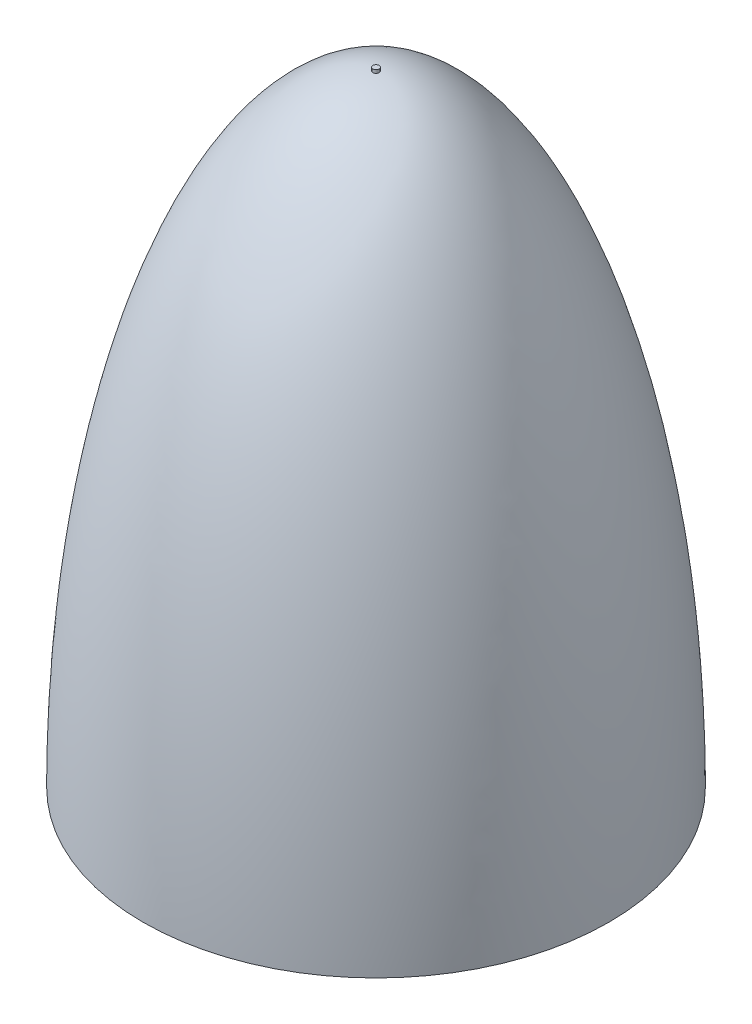
from build123d import *

# Parameters (mm, degrees)
SKETCH1_W = 4
SKETCH1_H = 4


with BuildPart() as part:
    # Sketch1 → Revolve1 (revolve)
    with BuildSketch(Plane.XY, mode=Mode.PRIVATE) as revolve1_sk:
        with BuildLine():
            add(Edge.make_bspline(
                [(4, -0.071114272), (2.000088897, 0), (0, 0)],
                knots=[6.269851579, 6.269851579, 6.269851579, 6.283185307, 6.283185307, 6.283185307], degree=2, weights=[1, 0.999977777, 1]))
            Line((0, 0), (300, -800))
            add(Edge.make_bspline(
                [(300, -800), (300, -10.596494347), (4, -0.071114272)],
                knots=[4.71238898, 4.71238898, 4.71238898, 6.269851579, 6.269851579, 6.269851579], degree=2, weights=[1, 0.711805217, 1]))
        make_face()
        with BuildLine():
            Line((4, 0), (0, 0))
            add(Edge.make_bspline(
                [(4, -0.071114272), (2.000088897, 0), (0, 0)],
                knots=[6.269851579, 6.269851579, 6.269851579, 6.283185307, 6.283185307, 6.283185307], degree=2, weights=[1, 0.999977777, 1]))
            Line((4, -0.071114272), (4, 0))
        make_face()
        with Locations((2, 2)):
            Rectangle(SKETCH1_W, SKETCH1_H)
    revolve(revolve1_sk.sketch.rotate(Axis((0, 0, 0), (0, -1, 0)), 270), axis=Axis((0, 0, 0), (0, -1, 0)))


solid = part.part
